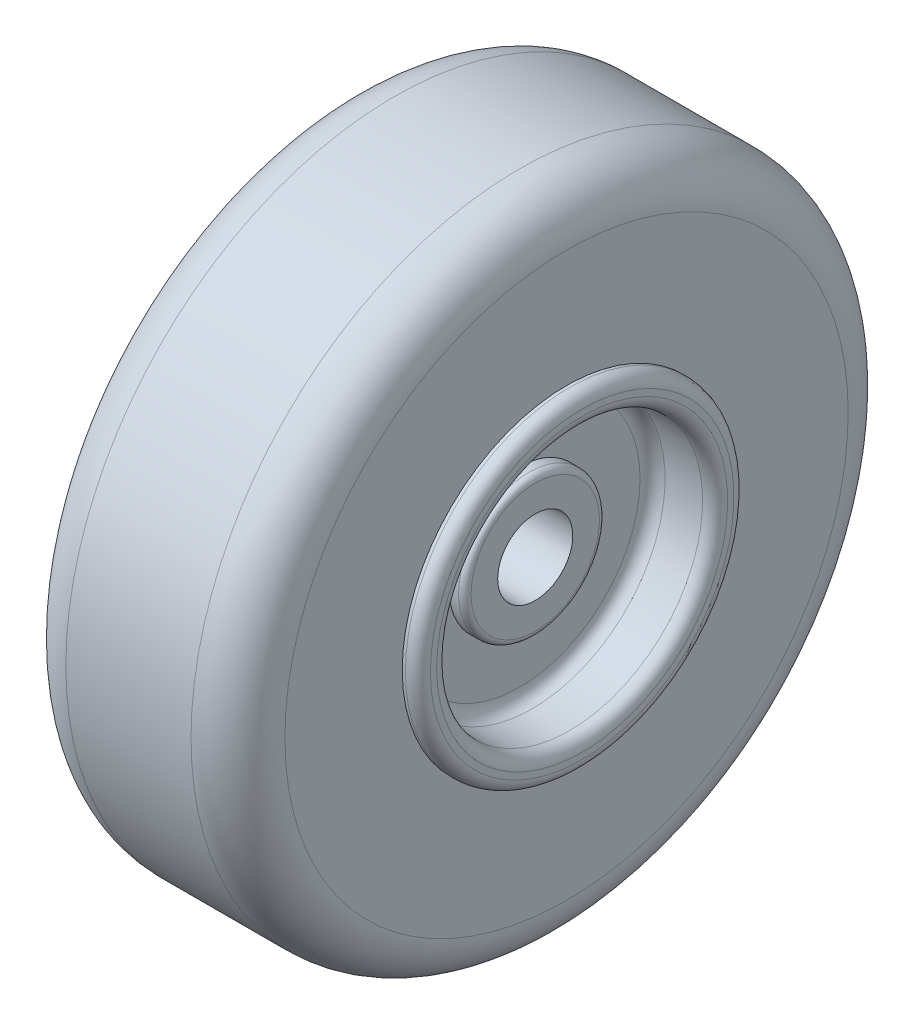
from build123d import *


with BuildPart() as part:
    # Esboço6 → Revolução2 (revolve)
    with BuildSketch(Plane.XY, mode=Mode.PRIVATE) as revolu_o2_sk:
        with BuildLine():
            Line((2.5, 1.2), (2.5, 2.05))
            ThreePointArc((2.5, 2.05), (2.441421356, 2.191421356), (2.3, 2.25))
            Line((2.3, 2.25), (2, 2.25))
            Line((2, 2.25), (2, 3.85))
            ThreePointArc((2, 3.85), (2.117157288, 4.132842712), (2.4, 4.25))
            Line((2.4, 4.25), (3.6, 4.25))
            ThreePointArc((3.6, 4.25), (3.882842712, 4.367157288), (4, 4.65))
            Line((4, 4.65), (4, 4.85))
            ThreePointArc((4, 4.85), (3.882842712, 5.132842712), (3.6, 5.25))
            Line((3.6, 5.25), (3.5, 5.25))
            Line((3.5, 5.25), (3.5, 9))
            ThreePointArc((3.5, 9), (3.060660172, 10.060660172), (2, 10.5))
            Line((2, 10.5), (-2, 10.5))
            ThreePointArc((-2, 10.5), (-3.060660172, 10.060660172), (-3.5, 9))
            Line((-3.5, 9), (-3.5, 5.25))
            Line((-3.5, 5.25), (-3.6, 5.25))
            ThreePointArc((-3.6, 5.25), (-3.882842712, 5.132842712), (-4, 4.85))
            Line((-4, 4.85), (-4, 4.65))
            ThreePointArc((-4, 4.65), (-3.882842712, 4.367157288), (-3.6, 4.25))
            Line((-3.6, 4.25), (-2.4, 4.25))
            ThreePointArc((-2.4, 4.25), (-2.117157288, 4.132842712), (-2, 3.85))
            Line((-2, 3.85), (-2, 2.25))
            Line((-2, 2.25), (-2.3, 2.25))
            ThreePointArc((-2.3, 2.25), (-2.441421356, 2.191421356), (-2.5, 2.05))
            Line((-2.5, 2.05), (-2.5, 1.2))
            Line((-2.5, 1.2), (2.5, 1.2))
        make_face()
    revolve(revolu_o2_sk.sketch.rotate(Axis((0, 0, 0), (1, 0, 0)), 90), axis=Axis((0, 0, 0), (1, 0, 0)))


solid = part.part
